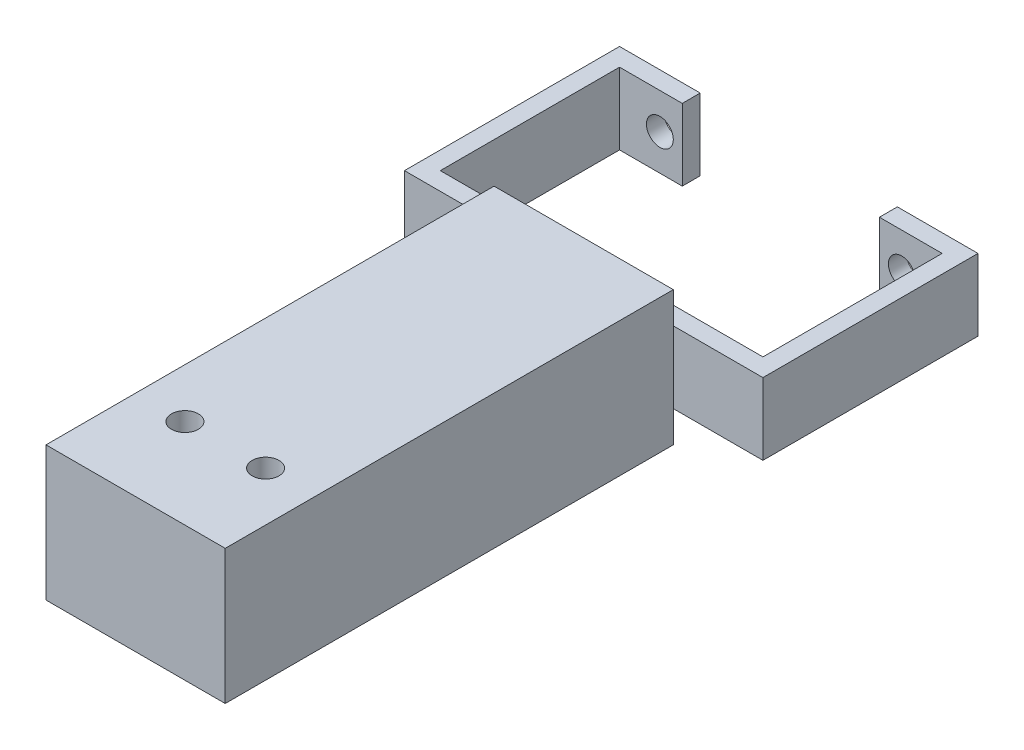
from build123d import *

# Parameters (mm, degrees)
SKETCH_8_W          = 9
SKETCH_8_H          = 8
SKETCH_8_R          = 1.5
EXTRUDE_1_DEPTH     = 2
EXTRUDE_1_2_DEPTH   = 2
SKETCH_9_W          = 2
SKETCH_9_H          = 8
EXTRUDE_2_DEPTH     = 20
SKETCH_10_W         = 40
SKETCH_10_H         = 8
EXTRUDE_3_DEPTH     = 2
SKETCH_11_W         = 20
SKETCH_11_H         = 15
EXTRUDE_4_DEPTH     = 50
SKETCH_12_R         = 1.5
CUT_EXTRUDE_1_DEPTH = 79.108898341


with BuildPart() as part:
    # Эскиз8 → Бобышка-Вытянуть1 (new body)
    with BuildSketch(Plane.XY):
        with Locations((-15.5, 0)):
            Rectangle(SKETCH_8_W, SKETCH_8_H)
        with Locations((-13.5, 0)):
            Circle(SKETCH_8_R, mode=Mode.SUBTRACT)
    extrude(amount=EXTRUDE_1_DEPTH)



with BuildPart() as body_2:
    # Эскиз8 → Extrude 1 2 (new body)
    with BuildSketch(Plane.XY):
        with Locations((15.5, 0)):
            Rectangle(SKETCH_8_W, SKETCH_8_H)
        with Locations((13.5, 0)):
            Circle(SKETCH_8_R, mode=Mode.SUBTRACT)
    extrude(amount=EXTRUDE_1_2_DEPTH)


with BuildPart() as part_1:
    add(part.part)

    add(body_2.part)  # Бобышка-Вытянуть2 merges body 2
    # Эскиз9 → Бобышка-Вытянуть2 (add)
    with BuildSketch(Plane.XY.offset(2)):
        with Locations((-19, 0)):
            Rectangle(SKETCH_9_W, SKETCH_9_H)
        with Locations((19, 0)):
            Rectangle(SKETCH_9_W, SKETCH_9_H)
    extrude(amount=EXTRUDE_2_DEPTH)

    # Эскиз10 → Бобышка-Вытянуть3 (add)
    with BuildSketch(Plane.XY.offset(22)):
        Rectangle(SKETCH_10_W, SKETCH_10_H)
    extrude(amount=EXTRUDE_3_DEPTH)

    # Эскиз11 → Бобышка-Вытянуть4 (add)
    with BuildSketch(Plane.XY.offset(24)):
        Rectangle(SKETCH_11_W, SKETCH_11_H)
    extrude(amount=EXTRUDE_4_DEPTH)

    # Эскиз12 → Вырез-Вытянуть1 (cut, through all)
    with BuildSketch(Plane(origin=(0, 7.5, 0), x_dir=(1, 0, 0), z_dir=(0, 1, 0))):
        with Locations(Location((-4.5, -64, 0), (0, 0, 270))):
            Circle(SKETCH_12_R)
        with Locations(Location((4.5, -64, 0), (0, 0, 270))):
            Circle(SKETCH_12_R)
    extrude(amount=-CUT_EXTRUDE_1_DEPTH, mode=Mode.SUBTRACT)


solid = part_1.part
